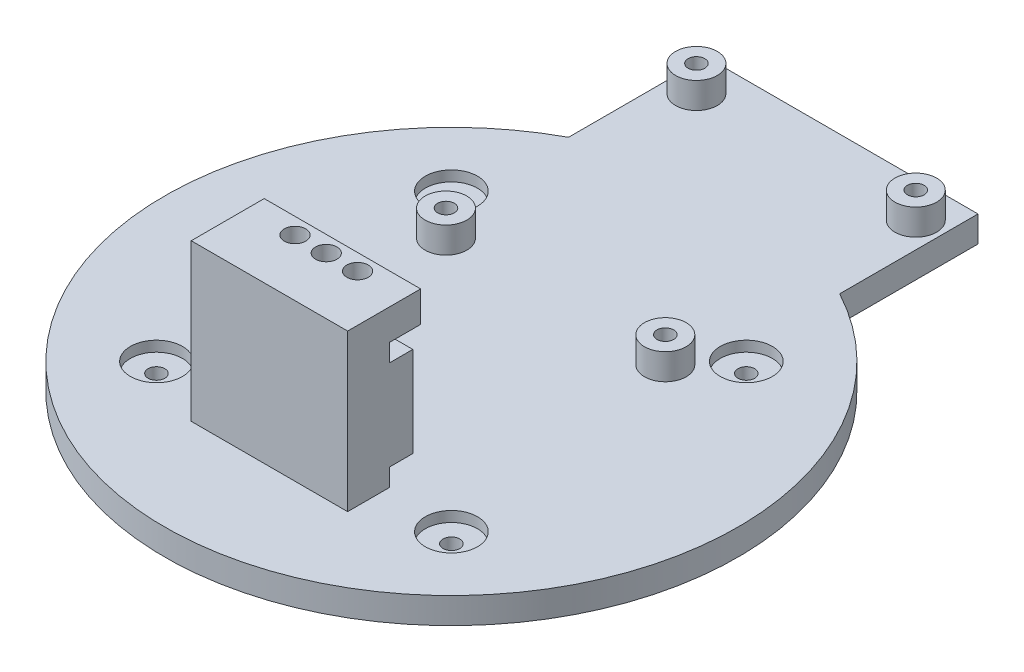
from build123d import *

# Parameters (mm, degrees)
SKETCH1_R           = 55
BOSS_EXTRUDE1_DEPTH = 5
SKETCH2_W           = 30
SKETCH2_H           = 14
BOSS_EXTRUDE2_DEPTH = 30
SKETCH6_R           = 2.05
CUT_EXTRUDE3_DEPTH  = 30
SKETCH7_W           = 30
SKETCH7_H           = 3.4
CUT_EXTRUDE4_DEPTH  = 6
SKETCH10_R          = 1.6
CUT_EXTRUDE5_DEPTH  = 6
SKETCH11_W          = 30
SKETCH11_H          = 17.3
CUT_EXTRUDE6_DEPTH  = 1.5
BOSS_EXTRUDE5_DEPTH = 5
SKETCH16_R          = 4
BOSS_EXTRUDE6_DEPTH = 5
SKETCH17_R          = 1.6
CUT_EXTRUDE8_DEPTH  = 97.306801421
SKETCH13_R          = 5
CUT_EXTRUDE9_DEPTH  = 2
CIRPATTERN3_COUNT   = 4


with BuildPart() as part:
    # Sketch1 → Boss-Extrude1 (new body)
    with BuildSketch(Plane(origin=(0, 0, 0), x_dir=(1, 0, 0), z_dir=(0, 1, 0))):
        with Locations(Location((0, 0, 0), (0, 0, 270))):
            Circle(SKETCH1_R)
    extrude(amount=BOSS_EXTRUDE1_DEPTH)

    # Sketch2 → Boss-Extrude2 (add)
    with BuildSketch(Plane(origin=(0, 5, 0), x_dir=(1, 0, 0), z_dir=(0, 1, 0))):
        with Locations((0, -27.9)):
            Rectangle(SKETCH2_W, SKETCH2_H)
    extrude(amount=BOSS_EXTRUDE2_DEPTH)

    # Sketch6 → Cut-Extrude3 (cut)
    with BuildSketch(Plane(origin=(0, 35, 0), x_dir=(1, 0, 0), z_dir=(0, 1, 0))):
        with Locations(Location((-6, -24, 0), (0, 0, 270))):
            Circle(SKETCH6_R)
        with Locations(Location((0, -24, 0), (0, 0, 270))):
            Circle(SKETCH6_R)
        with Locations(Location((6, -24, 0), (0, 0, 270))):
            Circle(SKETCH6_R)
    extrude(amount=-CUT_EXTRUDE3_DEPTH, mode=Mode.SUBTRACT)

    # Sketch7 → Cut-Extrude4 (cut)
    with BuildSketch(Plane(origin=(0, 0, 20.9), x_dir=(-1, 0, 0), z_dir=(0, 0, -1))):
        with Locations((0, 6.7)):
            Rectangle(SKETCH7_W, SKETCH7_H)
        with Locations((0, 27.4)):
            Rectangle(SKETCH7_W, SKETCH7_H)
    extrude(amount=-CUT_EXTRUDE4_DEPTH, mode=Mode.SUBTRACT)

    # Sketch10 → Cut-Extrude5 (cut)
    with BuildSketch(Plane.XZ):
        with Locations(Location((-28.284271247, 28.284271247, 0), (0, 0, 270))):
            Circle(SKETCH10_R)
        with Locations(Location((28.284271247, 28.284271247, 0), (0, 0, 270))):
            Circle(SKETCH10_R)
        with Locations(Location((28.284271247, -28.284271247, 0), (0, 0, 270))):
            Circle(SKETCH10_R)
        with Locations(Location((-28.284271247, -28.284271247, 0), (0, 0, 270))):
            Circle(SKETCH10_R)
    extrude(amount=-CUT_EXTRUDE5_DEPTH, mode=Mode.SUBTRACT)

    # Sketch11 → Cut-Extrude6 (cut)
    with BuildSketch(Plane(origin=(0, 0, 20.9), x_dir=(-1, 0, 0), z_dir=(0, 0, -1))):
        with Locations((0, 17.05)):
            Rectangle(SKETCH11_W, SKETCH11_H)
    extrude(amount=-CUT_EXTRUDE6_DEPTH, mode=Mode.SUBTRACT)

    # Sketch14 → Boss-Extrude5 (add)
    with BuildSketch(Plane.XZ):
        Polygon((-26, -48.466483264), (-26, -75), (26, -75), (26, -25), (-26, -25), align=None)
    extrude(amount=-BOSS_EXTRUDE5_DEPTH)

    # Sketch16 → Boss-Extrude6 (add)
    with BuildSketch(Plane(origin=(0, 5, 0), x_dir=(1, 0, 0), z_dir=(0, 1, 0))):
        with Locations(Location((-21, 68, 0), (0, 0, 270))):
            Circle(SKETCH16_R)
        with Locations(Location((21.07, 68, 0), (0, 0, 270))):
            Circle(SKETCH16_R)
        with Locations(Location((-21, 19.96, 0), (0, 0, 270))):
            Circle(SKETCH16_R)
        with Locations(Location((21.07, 19.96, 0), (0, 0, 270))):
            Circle(SKETCH16_R)
    extrude(amount=BOSS_EXTRUDE6_DEPTH)

    # Sketch17 → Cut-Extrude8 (cut, through all)
    with BuildSketch(Plane(origin=(0, 10, 0), x_dir=(1, 0, 0), z_dir=(0, 1, 0))):
        with Locations(Location((-21, 68, 0), (0, 0, 270))):
            Circle(SKETCH17_R)
        with Locations(Location((21.07, 68, 0), (0, 0, 270))):
            Circle(SKETCH17_R)
        with Locations(Location((21.07, 19.96, 0), (0, 0, 270))):
            Circle(SKETCH17_R)
        with Locations(Location((-21, 19.96, 0), (0, 0, 270))):
            Circle(SKETCH17_R)
    extrude(amount=-CUT_EXTRUDE8_DEPTH, mode=Mode.SUBTRACT)

    # Sketch13 → Cut-Extrude9 (cut)
    with BuildSketch(Plane(origin=(0, 5, 0), x_dir=(1, 0, 0), z_dir=(0, 1, 0))):
        with Locations(Location((-28.284271247, 28.284271247, 0), (0, 0, 270))):
            Circle(SKETCH13_R)
    cut_extrude9 = extrude(amount=-CUT_EXTRUDE9_DEPTH, mode=Mode.SUBTRACT)

    # CirPattern3: Cut-Extrude9 ×4 about axis
    cirpattern3_axis = Axis((0, 0, 0), (0, 1, 0))
    for i in range(1, CIRPATTERN3_COUNT):
        add(cut_extrude9.rotate(cirpattern3_axis, i * 360 / CIRPATTERN3_COUNT), mode=Mode.SUBTRACT)


solid = part.part
